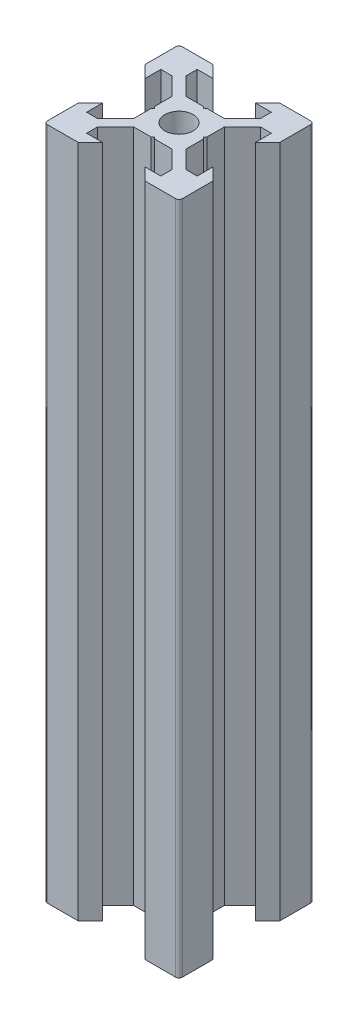
from build123d import *

# Parameters (mm, degrees)
SKETCH_28_R               = 2.075
EXTRUDE_2020V_DEPTH       = 100
HOLE_WIZARD_1_2020V_D     = 4.2
HOLE_WIZARD_1_2020V_DEPTH = 12.4
HOLE_WIZARD_1_2020V_TIP   = 1.2618073
HOLE_WIZARD_2_2020V_D     = 4.2
HOLE_WIZARD_2_2020V_DEPTH = 12.4
HOLE_WIZARD_2_2020V_TIP   = 1.2618073


with BuildPart() as part:
    # 草图28 → 2020V (new body)
    with BuildSketch(Plane(origin=(0, 0, 0), x_dir=(1, 0, 0), z_dir=(0, 1, 0))):
        with BuildLine():
            Line((-3.900000395, 2.839340223), (-3.900000395, 0.282843107))
            Line((-3.900000395, 0.282843107), (-3.617157288, 0))
            Line((-3.617157288, 0), (-3.9, -0.282842712))
            Line((-3.9, -0.282842712), (-3.9, -2.839339828))
            Line((-3.9, -2.839339828), (-6.560660172, -5.5))
            Line((-6.560660172, -5.5), (-8.2, -5.5))
            Line((-8.2, -5.5), (-8.2, -3.150000255))
            Line((-8.2, -3.150000255), (-10, -4.950000255))
            Line((-10, -4.950000255), (-10, -9.5))
            ThreePointArc((-10, -9.5), (-9.853553391, -9.853553391), (-9.5, -10))
            Line((-9.5, -10), (-4.950000255, -10))
            Line((-4.950000255, -10), (-3.150000255, -8.2))
            Line((-3.150000255, -8.2), (-5.5, -8.2))
            Line((-5.5, -8.2), (-5.5, -6.560660172))
            Line((-5.5, -6.560660172), (-2.839339828, -3.9))
            Line((-2.839339828, -3.9), (-0.282842712, -3.9))
            Line((-0.282842712, -3.9), (0, -3.617157288))
            Line((0, -3.617157288), (0.282842712, -3.9))
            Line((0.282842712, -3.9), (2.839339828, -3.9))
            Line((2.839339828, -3.9), (5.5, -6.560660172))
            Line((5.5, -6.560660172), (5.5, -8.2))
            Line((5.5, -8.2), (3.150000255, -8.2))
            Line((3.150000255, -8.2), (4.950000255, -10))
            Line((4.950000255, -10), (9.5, -10))
            ThreePointArc((9.5, -10), (9.853553391, -9.853553391), (10, -9.5))
            Line((10, -9.5), (10, -4.950000255))
            Line((10, -4.950000255), (8.2, -3.150000255))
            Line((8.2, -3.150000255), (8.2, -5.5))
            Line((8.2, -5.5), (6.560660172, -5.5))
            Line((6.560660172, -5.5), (3.9, -2.839339828))
            Line((3.9, -2.839339828), (3.9, -0.282842712))
            Line((3.9, -0.282842712), (3.617157288, 0))
            Line((3.617157288, 0), (3.900000116, 0.282842829))
            Line((3.900000116, 0.282842829), (3.900000116, 2.839339944))
            Line((3.900000116, 2.839339944), (6.560660288, 5.500000116))
            Line((6.560660288, 5.500000116), (8.200000116, 5.500000116))
            Line((8.200000116, 5.500000116), (8.200000116, 3.150000371))
            Line((8.200000116, 3.150000371), (10.000000116, 4.950000371))
            Line((10.000000116, 4.950000371), (10.000000116, 9.499999884))
            ThreePointArc((10.000000116, 9.499999884), (9.853553507, 9.853553275), (9.500000116, 9.999999884))
            Line((9.500000116, 9.999999884), (4.950000139, 9.999999884))
            Line((4.950000139, 9.999999884), (3.150000139, 8.199999884))
            Line((3.150000139, 8.199999884), (5.499999884, 8.199999884))
            Line((5.499999884, 8.199999884), (5.499999884, 6.560660056))
            Line((5.499999884, 6.560660056), (2.839339712, 3.899999884))
            Line((2.839339712, 3.899999884), (0.282842991, 3.899999884))
            Line((0.282842991, 3.899999884), (0, 3.617156893))
            Line((0, 3.617156893), (-0.282842712, 3.899999605))
            Line((-0.282842712, 3.899999605), (-2.839339434, 3.899999605))
            Line((-2.839339434, 3.899999605), (-5.499999605, 6.560659777))
            Line((-5.499999605, 6.560659777), (-5.499999605, 8.199999605))
            Line((-5.499999605, 8.199999605), (-3.149999861, 8.199999605))
            Line((-3.149999861, 8.199999605), (-4.949999861, 9.999999605))
            Line((-4.949999861, 9.999999605), (-9.500000395, 9.999999605))
            ThreePointArc((-9.500000395, 9.999999605), (-9.853553785, 9.853552996), (-10.000000395, 9.499999605))
            Line((-10.000000395, 9.499999605), (-10.000000395, 4.95000065))
            Line((-10.000000395, 4.95000065), (-8.200000395, 3.15000065))
            Line((-8.200000395, 3.15000065), (-8.200000395, 5.500000395))
            Line((-8.200000395, 5.500000395), (-6.560660566, 5.500000395))
            Line((-6.560660566, 5.500000395), (-3.900000395, 2.839340223))
        make_face()
        with Locations(Location((0, 0, 0), (0, 0, 270))):
            Circle(SKETCH_28_R, mode=Mode.SUBTRACT)
    extrude(amount=EXTRUDE_2020V_DEPTH)

    # 1-2020V
    with Locations(Plane(origin=(0, 100, 0), x_dir=(1, 0, 0), z_dir=(0, 1, 0))):
        with Locations((0, 0)):
            Hole(HOLE_WIZARD_1_2020V_D / 2, depth=HOLE_WIZARD_1_2020V_DEPTH)
            with Locations((0, 0, -(HOLE_WIZARD_1_2020V_DEPTH + HOLE_WIZARD_1_2020V_TIP / 2))):  # 118° drill point
                Cone(0, HOLE_WIZARD_1_2020V_D / 2, HOLE_WIZARD_1_2020V_TIP, mode=Mode.SUBTRACT)

    # 2-2020V
    with Locations(Plane(origin=(0, 0, 0), x_dir=(-1, 0, 0), z_dir=(0, -1, 0))):
        with Locations((0, 0)):
            Hole(HOLE_WIZARD_2_2020V_D / 2, depth=HOLE_WIZARD_2_2020V_DEPTH)
            with Locations((0, 0, -(HOLE_WIZARD_2_2020V_DEPTH + HOLE_WIZARD_2_2020V_TIP / 2))):  # 118° drill point
                Cone(0, HOLE_WIZARD_2_2020V_D / 2, HOLE_WIZARD_2_2020V_TIP, mode=Mode.SUBTRACT)


solid = part.part
